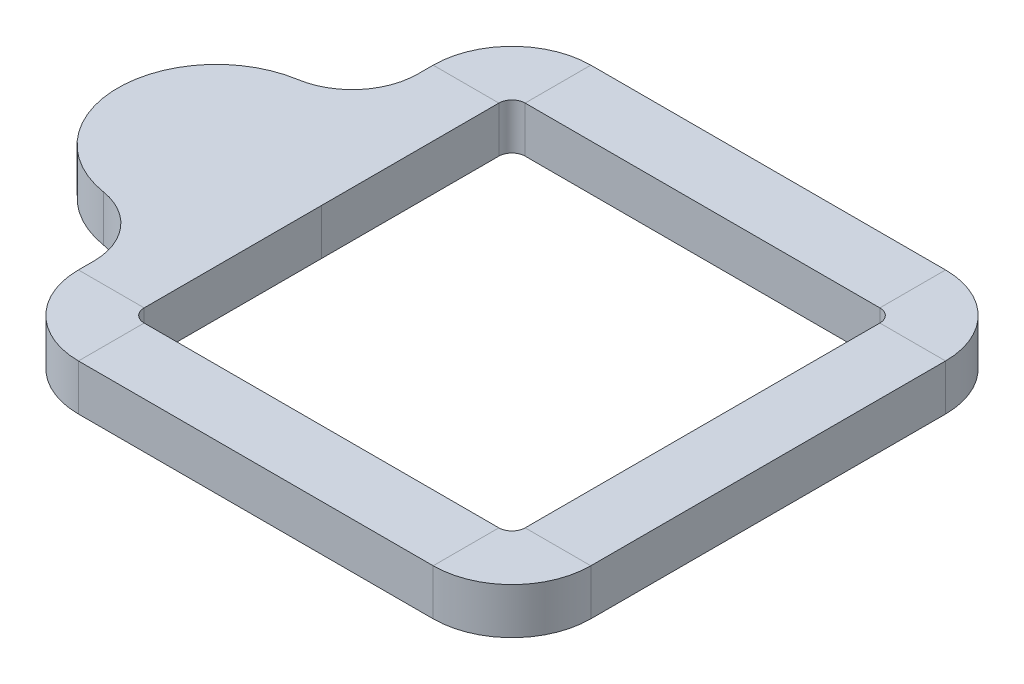
from build123d import *

# Parameters (mm, degrees)
SKETCH_1_W      = 5
SKETCH_1_H      = 3.5
EXTRUDE_1_DEPTH = 3.5
FILLET_1_R      = 5


with BuildPart() as part:
    # По траектории1: sweep along a path in Эскиз2
    with BuildLine(Plane(origin=(0, 6.25, 0), x_dir=(-1, 0, 0), z_dir=(0, -1, 0))) as sweep_1_path:
        Line((30.926565187, 15.32695004), (30.926565187, -11.67304996))
        ThreePointArc((30.926565187, -11.67304996), (30.633671968, -12.380156741), (29.926565187, -12.67304996))
        Line((29.926565187, -12.67304996), (2.926565187, -12.67304996))
        ThreePointArc((2.926565187, -12.67304996), (2.219458406, -12.380156741), (1.926565187, -11.67304996))
        Line((1.926565187, -11.67304996), (1.926565187, 15.32695004))
        ThreePointArc((1.926565187, 15.32695004), (2.219458406, 16.034056821), (2.926565187, 16.32695004))
        Line((2.926565187, 16.32695004), (29.926565187, 16.32695004))
        ThreePointArc((29.926565187, 16.32695004), (30.633671968, 16.034056821), (30.926565187, 15.32695004))
    # Эскиз1 → По траектории1 (sweep)
    with BuildSketch(Plane(origin=(0.073434813, 0, -1.82695004), x_dir=(1, 0, 0), z_dir=(0, 0, -1))):
        with Locations((-33.5, -8)):
            Rectangle(SKETCH_1_W, SKETCH_1_H)
    sweep(path=sweep_1_path.line)

    # Эскиз3 → Бобышка-Вытянуть1 (add)
    with BuildSketch(Plane(origin=(0, 9.75, 0), x_dir=(1, 0, 0), z_dir=(0, 1, 0))):
        with BuildLine():
            Line((-38.926565187, 9.32695004), (-35.926565187, 9.32695004))
            Line((-35.926565187, 9.32695004), (-35.926565187, -5.67304996))
            Line((-35.926565187, -5.67304996), (-38.926565187, -5.67304996))
            ThreePointArc((-38.926565187, -5.67304996), (-46.426565187, 1.82695004), (-38.926565187, 9.32695004))
        make_face()
    extrude(amount=-EXTRUDE_1_DEPTH)

    # Скругление1
    fillet_1_edges = [part.edges().sort_by_distance(p)[0] for p in [
        (-35.926565187, 8, -9.32695004),
        (-35.926565187, 8, 5.67304996),
    ]]
    fillet(fillet_1_edges, radius=FILLET_1_R)


solid = part.part
